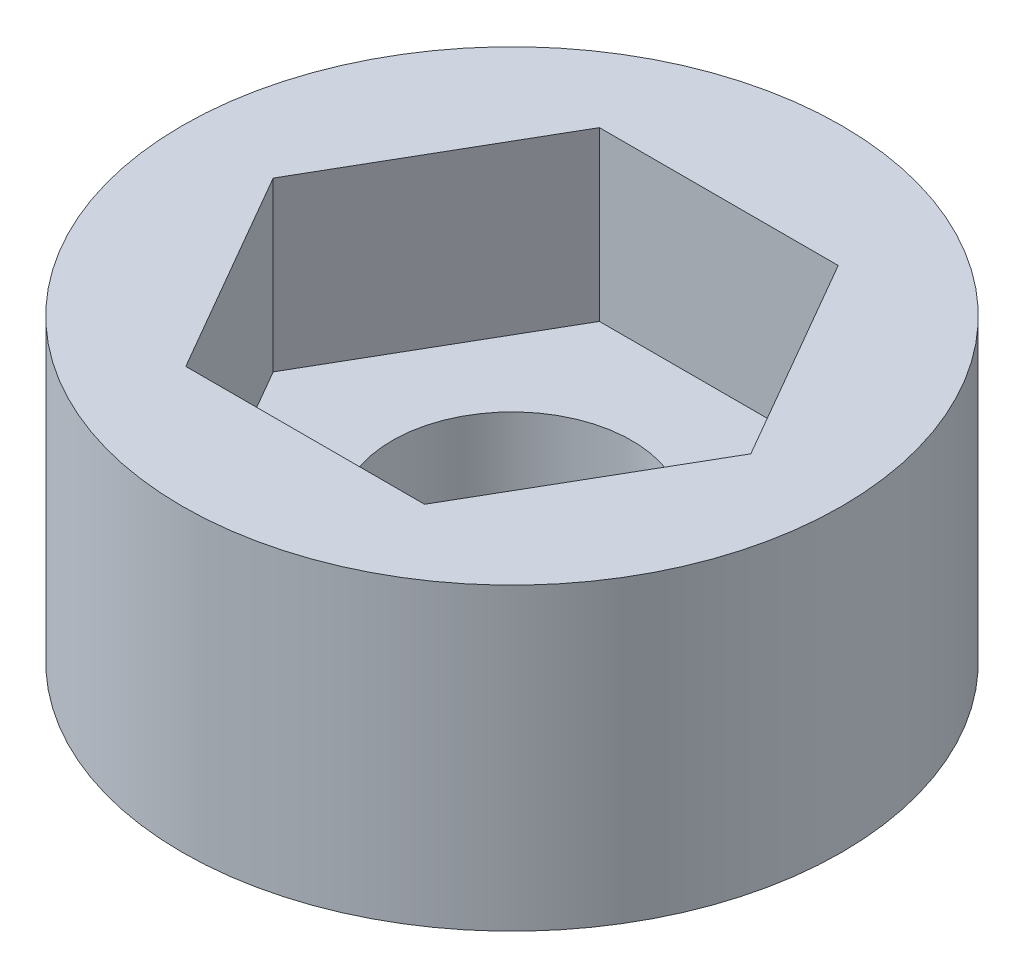
from build123d import *

# Parameters (mm, degrees)
SKETCH1_R           = 11
SKETCH1_R_2         = 4
BOSS_EXTRUDE1_DEPTH = 10
CUT_EXTRUDE1_DEPTH  = 5.6


with BuildPart() as part:
    # Sketch1 → Boss-Extrude1 (new body)
    with BuildSketch(Plane(origin=(0, 0, 0), x_dir=(1, 0, 0), z_dir=(0, 1, 0))):
        with Locations(Location((0, 0, 0), (0, 0, 270))):
            Circle(SKETCH1_R)
        with Locations(Location((0, 0, 0), (0, 0, 270))):
            Circle(SKETCH1_R_2, mode=Mode.SUBTRACT)
    extrude(amount=BOSS_EXTRUDE1_DEPTH)

    # Sketch2 → Cut-Extrude1 (cut)
    with BuildSketch(Plane(origin=(0, 10, 0), x_dir=(1, 0, 0), z_dir=(0, 1, 0))):
        Polygon((3.983716857, 6.9), (-3.983716857, 6.9), (-7.967433715, 0), (-3.983716857, -6.9), (3.983716857, -6.9), (7.967433715, 0), align=None)
    extrude(amount=-CUT_EXTRUDE1_DEPTH, mode=Mode.SUBTRACT)


solid = part.part
